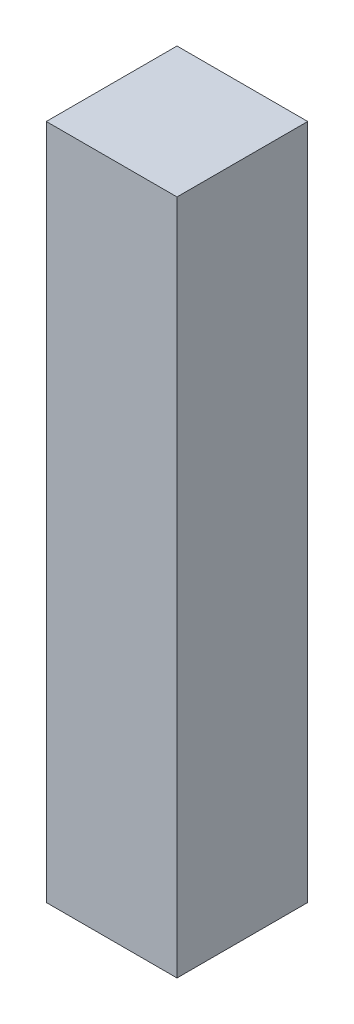
from build123d import *

# Parameters (mm, degrees)
SKETCH1_W           = 75
SKETCH1_H           = 75
BOSS_EXTRUDE1_DEPTH = 388.112


with BuildPart() as part:
    # Sketch1 → Boss-Extrude1 (new body)
    with BuildSketch(Plane(origin=(0, 0, 0), x_dir=(1, 0, 0), z_dir=(0, 1, 0))):
        with Locations((37.5, 37.5)):
            Rectangle(SKETCH1_W, SKETCH1_H)
    extrude(amount=BOSS_EXTRUDE1_DEPTH)


solid = part.part
